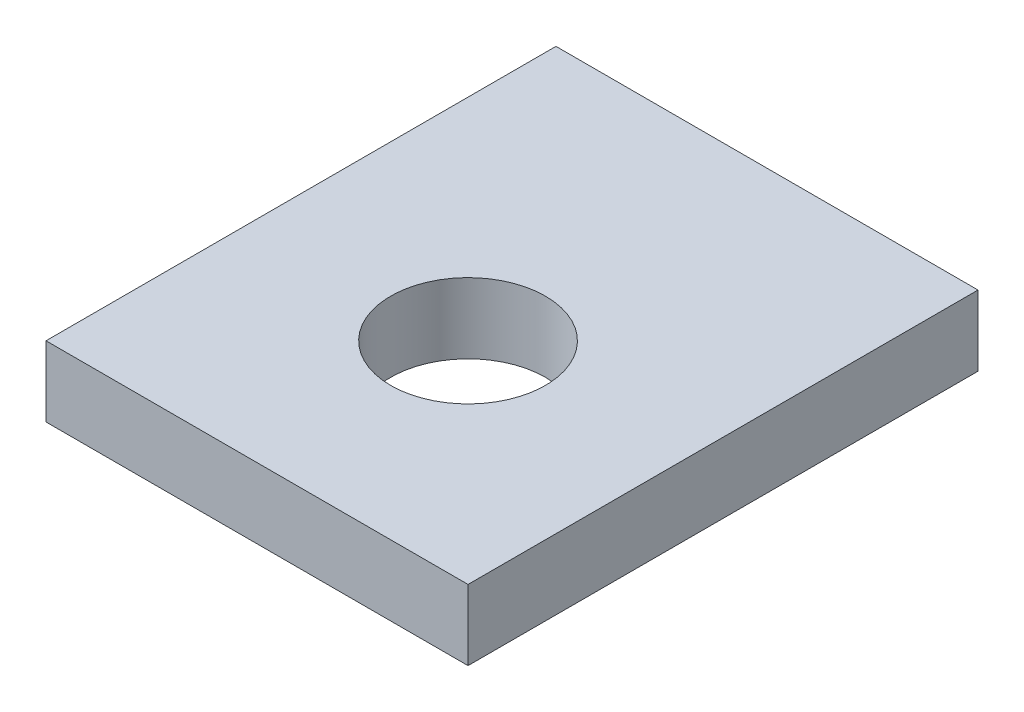
from build123d import *

# Parameters (mm, degrees)
MAIN_PROFILE_SKETCH_W = 6
MAIN_PROFILE_SKETCH_H = 7.25
MAIN_PROFILE_SKETCH_R = 1.1
MAIN_EXTRUSION_DEPTH  = 1


with BuildPart() as part:
    # Main Profile Sketch → Main Extrusion (new body)
    with BuildSketch(Plane(origin=(0, -203.2, 0), x_dir=(-1, 0, 0), z_dir=(0, -1, 0))):
        with Locations((19.009182883, 39.369882879)):
            Rectangle(MAIN_PROFILE_SKETCH_W, MAIN_PROFILE_SKETCH_H)
        with Locations(Location((19.009182883, 38.744882879, 0), (0, 0, 90))):
            Circle(MAIN_PROFILE_SKETCH_R, mode=Mode.SUBTRACT)
    extrude(amount=MAIN_EXTRUSION_DEPTH)


solid = part.part
